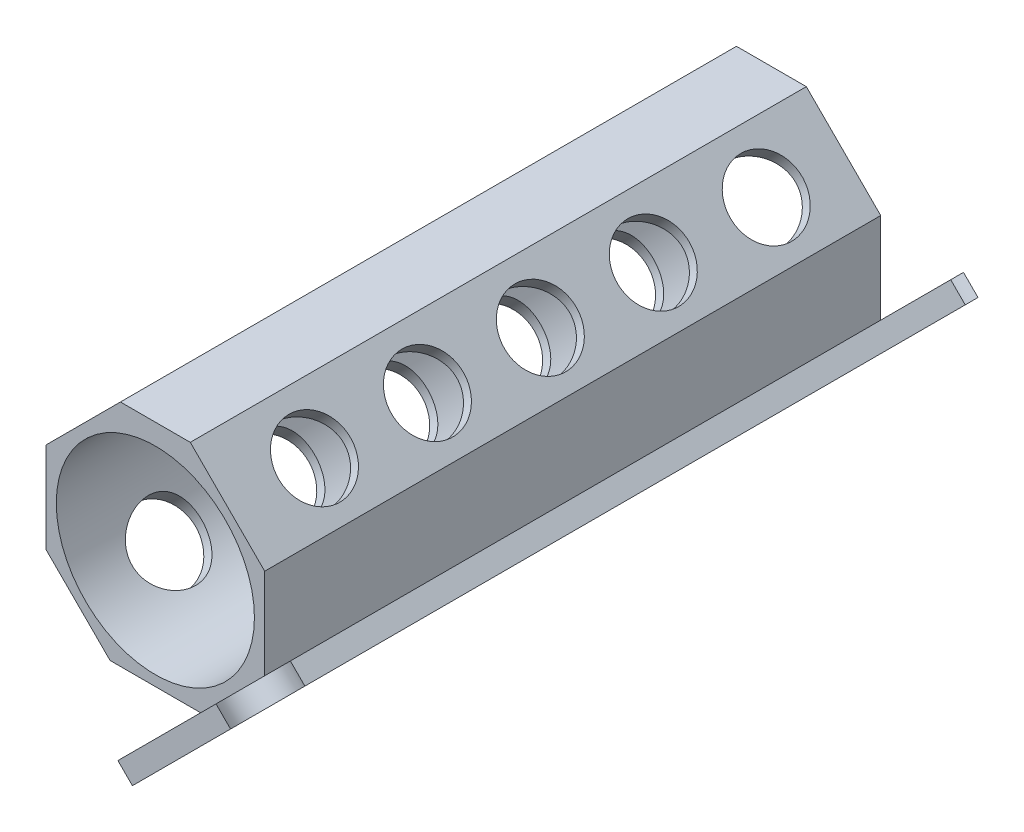
from build123d import *

# Parameters (mm, degrees)
SKIZZE1_R                        = 9.65
AUFSATZ_LINEAR_AUSTRAGEN1_DEPTH  = 60
SKIZZE9_R                        = 3.5
SCHNITT_LINEAR_AUSTRAGEN8_DEPTH  = 66.276908441
SKIZZE13_W                       = 22
SKIZZE13_H                       = 72.8
AUFSATZ_LINEAR_AUSTRAGEN2_DEPTH  = 2
SKIZZE14_R                       = 3
SCHNITT_LINEAR_AUSTRAGEN12_DEPTH = 2


with BuildPart() as part:
    # Skizze1 → Aufsatz-Linear austragen1 (new body)
    with BuildSketch(Plane(origin=(0, 0, 0), x_dir=(0, 1, 0), z_dir=(0, 0, 1))):
        Polygon((11.65888225, 3.402492189), (11.65888225, -3.402492189), (4.411374439, -10.65), (-4.411374439, -10.65), (-10.65, -4.411374439), (-10.65, 4.411374439), (-4.411374439, 10.65), (4.411374439, 10.65), align=None)
        with Locations(Location((0, 0, 0), (0, 0, 270))):
            Circle(SKIZZE1_R, mode=Mode.SUBTRACT)
    extrude(amount=AUFSATZ_LINEAR_AUSTRAGEN1_DEPTH)

    # Skizze9 → Schnitt-Linear austragen8 (cut, through all)
    with BuildSketch(Plane(origin=(7.53068722, 7.53068722, 0), x_dir=(-0.7071067811865476, 0.7071067811865475, 0), z_dir=(0.7071067811865475, 0.7071067811865476, 0))):
        with Locations((0.613513233, 51.6)):
            Circle(SKIZZE9_R)
        with Locations((0.613513233, 40.6)):
            Circle(SKIZZE9_R)
        with Locations((0.613513233, 29.6)):
            Circle(SKIZZE9_R)
        with Locations((0.613513233, 18.6)):
            Circle(SKIZZE9_R)
        with Locations((0.613513233, 7.6)):
            Circle(SKIZZE9_R)
    extrude(amount=-SCHNITT_LINEAR_AUSTRAGEN8_DEPTH, mode=Mode.SUBTRACT)

    # Skizze13 → Aufsatz-Linear austragen2 (add)
    with BuildSketch(Plane(origin=(7.53068722, -7.53068722, 0), x_dir=(0.7071067811865477, 0.7071067811865475, 0), z_dir=(0.7071067811865475, -0.7071067811865477, 0))):
        with Locations((0, 30)):
            Rectangle(SKIZZE13_W, SKIZZE13_H)
    extrude(amount=AUFSATZ_LINEAR_AUSTRAGEN2_DEPTH)

    # Skizze14 → Schnitt-Linear austragen12 (cut)
    with BuildSketch(Plane(origin=(8.944900782, -8.944900782, 0), x_dir=(0.7071067811865478, 0.7071067811865474, 0), z_dir=(0.7071067811865474, -0.7071067811865478, 0))):
        with Locations((8.88, 64.28)):
            Circle(SKIZZE14_R)
        with Locations((-8.88, -4.28)):
            Circle(SKIZZE14_R)
        with Locations((8.88, -4.28)):
            Circle(SKIZZE14_R)
        with Locations((-8.88, 64.28)):
            Circle(SKIZZE14_R)
    extrude(amount=-SCHNITT_LINEAR_AUSTRAGEN12_DEPTH, mode=Mode.SUBTRACT)


solid = part.part
